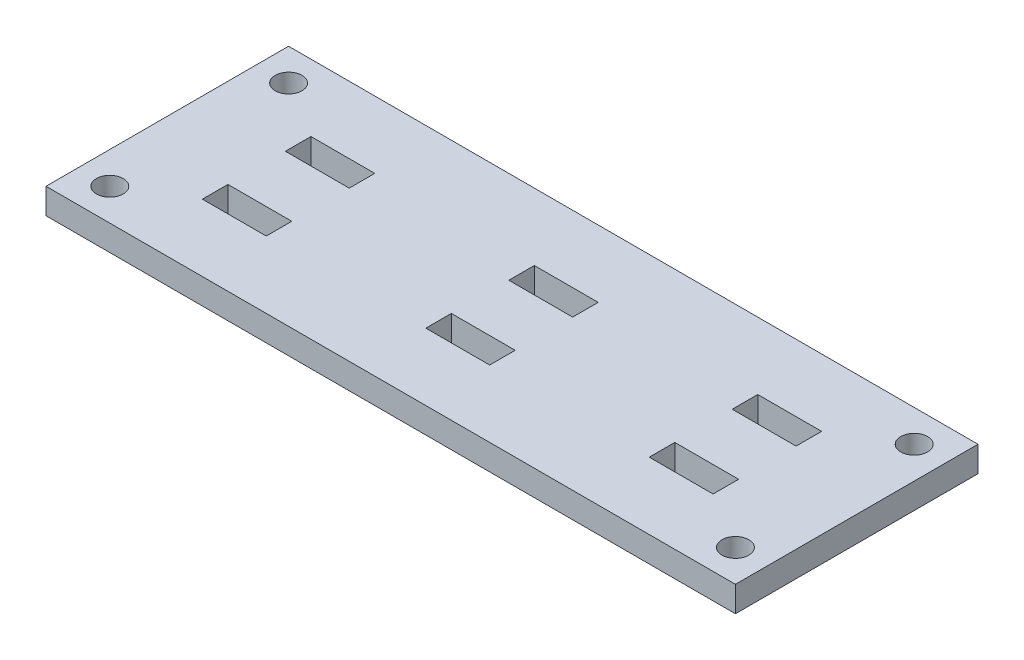
from build123d import *

# Parameters (mm, degrees)
SKETCH1_W           = 108
SKETCH1_H           = 38
SKETCH1_R           = 2.1
SKETCH1_W_2         = 10
SKETCH1_H_2         = 4
BOSS_EXTRUDE1_DEPTH = 4


with BuildPart() as part:
    # Sketch1 → Boss-Extrude1 (new body)
    with BuildSketch(Plane(origin=(0, 0, 0), x_dir=(1, 0, 0), z_dir=(0, 1, 0))):
        with Locations((54, 19)):
            Rectangle(SKETCH1_W, SKETCH1_H)
        with Locations(Location((5, 33, 0), (0, 0, 270))):
            Circle(SKETCH1_R, mode=Mode.SUBTRACT)
        with Locations(Location((5, 5, 0), (0, 0, 270))):
            Circle(SKETCH1_R, mode=Mode.SUBTRACT)
        with Locations(Location((103, 5, 0), (0, 0, 270))):
            Circle(SKETCH1_R, mode=Mode.SUBTRACT)
        with Locations(Location((103, 33, 0), (0, 0, 270))):
            Circle(SKETCH1_R, mode=Mode.SUBTRACT)
        with Locations((19, 12.5)):
            Rectangle(SKETCH1_W_2, SKETCH1_H_2, mode=Mode.SUBTRACT)
        with Locations((19, 25.5)):
            Rectangle(SKETCH1_W_2, SKETCH1_H_2, mode=Mode.SUBTRACT)
        with Locations((54, 25.5)):
            Rectangle(SKETCH1_W_2, SKETCH1_H_2, mode=Mode.SUBTRACT)
        with Locations((54, 12.5)):
            Rectangle(SKETCH1_W_2, SKETCH1_H_2, mode=Mode.SUBTRACT)
        with Locations((89, 25.5)):
            Rectangle(SKETCH1_W_2, SKETCH1_H_2, mode=Mode.SUBTRACT)
        with Locations((89, 12.5)):
            Rectangle(SKETCH1_W_2, SKETCH1_H_2, mode=Mode.SUBTRACT)
    extrude(amount=BOSS_EXTRUDE1_DEPTH)


solid = part.part
